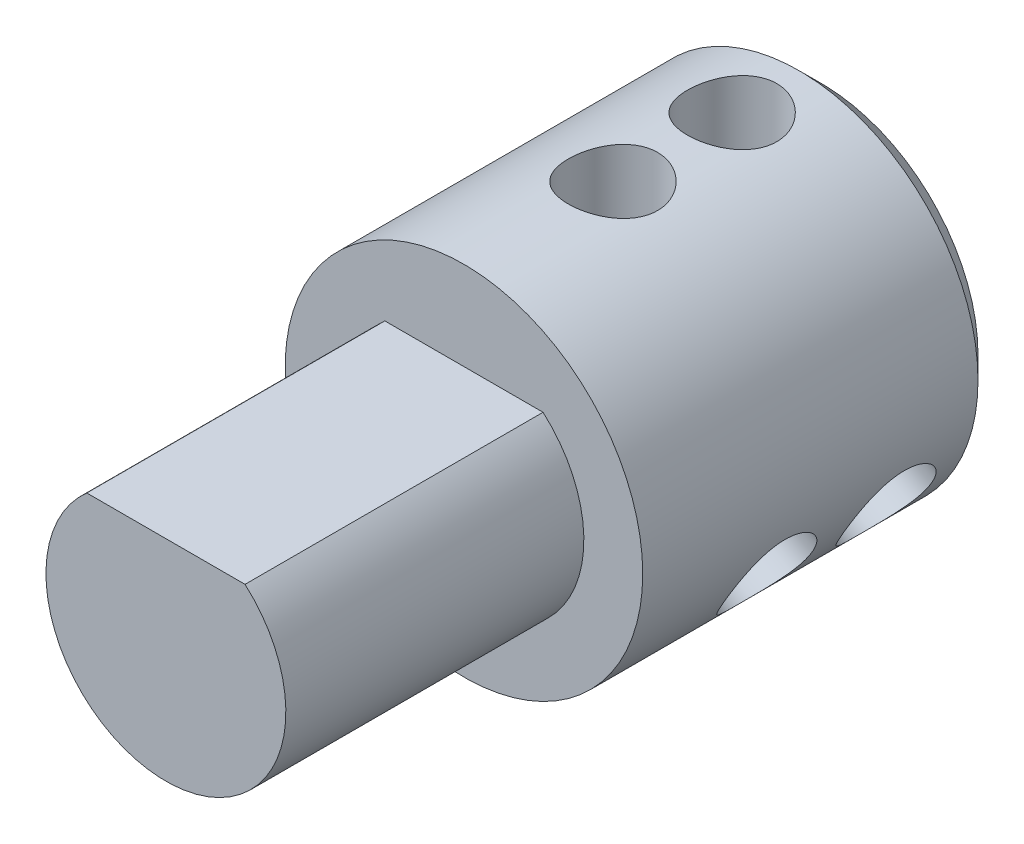
from build123d import *

# Parameters (mm, degrees)
SKETCH1_R               = 6
BOSS_EXTRUDE1_DEPTH     = 10
CUT_EXTRUDE1_REACH      = 15.115
CUT_EXTRUDE1_END_RADIUS = 6
SKETCH3_R               = 1.5
SKETCH4_R               = 6
BOSS_EXTRUDE2_DEPTH     = 2
BOSS_EXTRUDE3_DEPTH     = 10
CHAMFER1_SIZE           = 0.75
CIRPATTERN1_COUNT       = 3


with BuildPart() as part:
    # Sketch1 → Boss-Extrude1 (new body)
    with BuildSketch(Plane.XY):
        Circle(SKETCH1_R)
        with BuildLine():
            Line((-1.598436736, 1.475), (1.598436736, 1.475))
            ThreePointArc((1.598436736, 1.475), (0, -2.175), (-1.598436736, 1.475))
        make_face(mode=Mode.SUBTRACT)
    extrude(amount=BOSS_EXTRUDE1_DEPTH)

    # Cut-Extrude1: up to this cylinder (the profile starts inside it)
    cut_extrude1_end = Plane(origin=(0, 0, 5), z_dir=(0, 0, -1)) * Cylinder(CUT_EXTRUDE1_END_RADIUS, 47.23, mode=Mode.PRIVATE)
    # Sketch3 → Cut-Extrude1 (cut, up to the surface)
    with BuildSketch(Plane(origin=(0, 0, 0), x_dir=(1, 0, 0), z_dir=(0, 1, 0)), mode=Mode.PRIVATE) as cut_extrude1_sk1:
        with Locations(Location((0, -3, 0), (0, 0, 90))):
            Circle(SKETCH3_R)
    cut_extrude1_tool1 = extrude(cut_extrude1_sk1.sketch, amount=CUT_EXTRUDE1_REACH, mode=Mode.PRIVATE) & cut_extrude1_end
    # Sketch3 → Cut-Extrude1 (cut, up to the surface)
    with BuildSketch(Plane(origin=(0, 0, 0), x_dir=(1, 0, 0), z_dir=(0, 1, 0)), mode=Mode.PRIVATE) as cut_extrude1_sk2:
        with Locations(Location((0, -7, 0), (0, 0, 90))):
            Circle(SKETCH3_R)
    cut_extrude1_tool2 = extrude(cut_extrude1_sk2.sketch, amount=CUT_EXTRUDE1_REACH, mode=Mode.PRIVATE) & cut_extrude1_end
    cut_extrude1 = cut_extrude1_tool1.solids().sort_by_distance((0, 0, 3))[0] + cut_extrude1_tool2.solids().sort_by_distance((0, 0, 7))[0]
    add(cut_extrude1, mode=Mode.SUBTRACT)

    # Sketch4 → Boss-Extrude2 (add)
    with BuildSketch(Plane.XY.offset(10)):
        Circle(SKETCH4_R)
    extrude(amount=BOSS_EXTRUDE2_DEPTH)

    # Sketch6 → Boss-Extrude3 (add)
    with BuildSketch(Plane.XY.offset(12)):
        with BuildLine():
            Line((2.655183609, 3.025), (-2.655183609, 3.025))
            ThreePointArc((-2.655183609, 3.025), (-1.660348001, -3.666588266), (4.025, 0))
            ThreePointArc((4.025, 0), (3.666588266, 1.660348001), (2.655183609, 3.025))
        make_face()
    extrude(amount=BOSS_EXTRUDE3_DEPTH)

    # Chamfer1
    chamfer1_edges = [part.edges().sort_by_distance(p)[0] for p in [
        (-6, 0, 0),
    ]]
    chamfer(chamfer1_edges, length=CHAMFER1_SIZE)

    # CirPattern1: Cut-Extrude1 ×3 about axis
    cirpattern1_axis = Axis((0, 0, 0), (0, 0, -1))
    for i in range(1, CIRPATTERN1_COUNT):
        add(cut_extrude1.rotate(cirpattern1_axis, i * 360 / CIRPATTERN1_COUNT), mode=Mode.SUBTRACT)


solid = part.part
